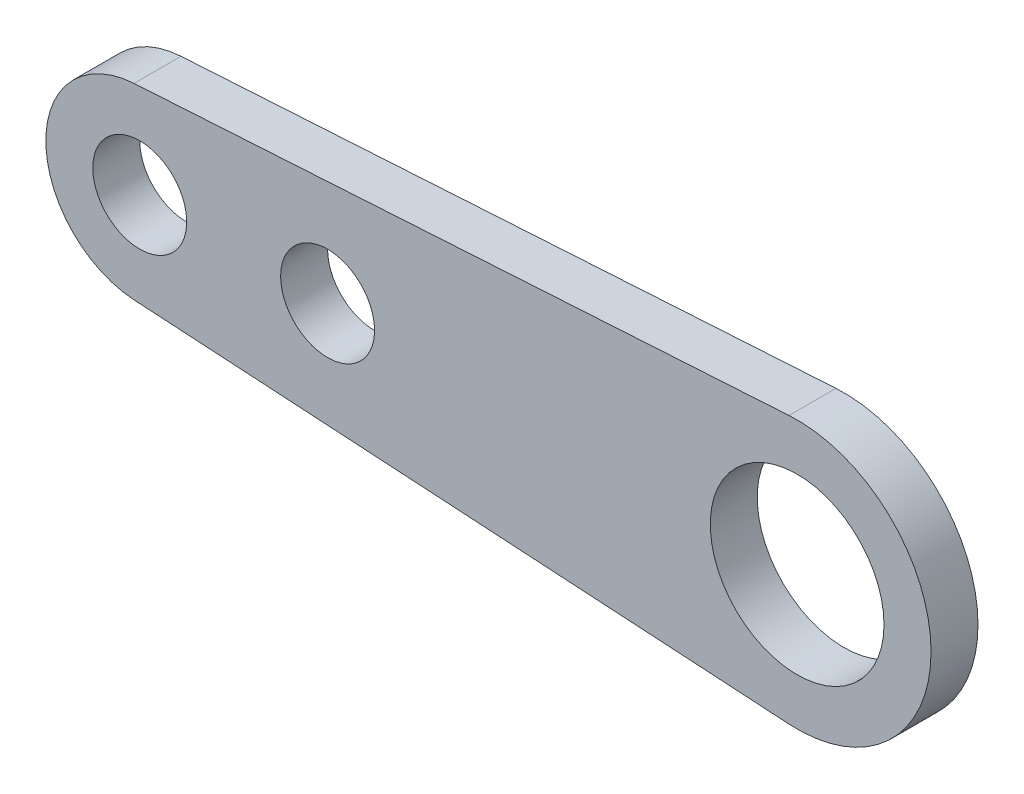
from build123d import *
from build123d.topology import SkipClean

# Parameters (mm, degrees)
BOSS_EXTRUDE1_DEPTH = 10


with BuildPart() as part:
    # Sketch1 → Boss-Extrude1 (new body)
    with BuildSketch(Plane(origin=(0, 0, 0), x_dir=(-1, 0, 0), z_dir=(0, 0, 1))):
        with BuildLine():
            Line((0, 0), (10.014962741, 0))
            ThreePointArc((10.014962741, 0), (28.514962741, 18.5), (47.014962741, 0))
            Line((47.014962741, 0), (118.514962741, 0))
            ThreePointArc((118.514962741, 0), (128.514962741, 10), (138.514962741, 0))
            Line((138.514962741, 0), (158.514962741, 0))
            ThreePointArc((158.514962741, 0), (168.514962741, 10), (178.514962741, 0))
            Line((178.514962741, 0), (188.514962741, 0))
            ThreePointArc((188.514962741, 0), (183.080821195, 13.70531895), (169.73138599, 19.962973588))
            Line((169.73138599, 19.962973588), (30.249275922, 28.462172403))
            ThreePointArc((30.249275922, 28.462172403), (8.974629781, 20.767245555), (0, 0))
        make_face()
    boss_extrude1 = extrude(amount=BOSS_EXTRUDE1_DEPTH)

    # Mirror1: Boss-Extrude1 across plane
    with SkipClean():  # the faces are left unmerged after this step: merging them gives an invalid solid
        add(boss_extrude1.mirror(Plane(origin=(-47.014962741, 0, 10), x_dir=(0, 0, 1), z_dir=(0, -1, 0))))


solid = part.part
